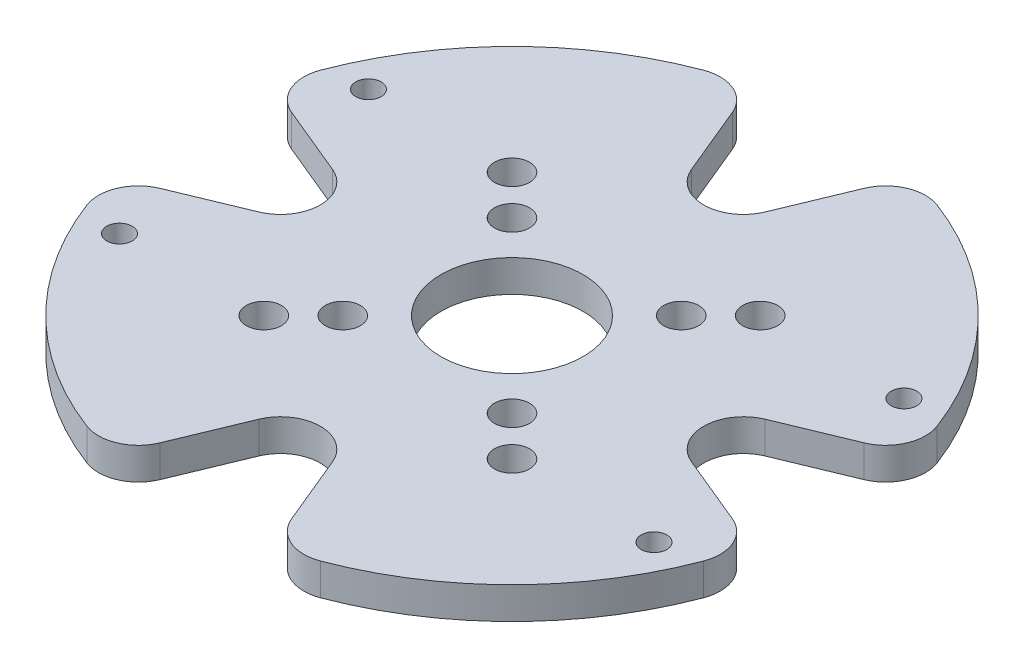
from build123d import *

# Parameters (mm, degrees)
SKETCH1_R                = 41.332242953
SKETCH1_R_2              = 1.6
BOSS_EXTRUDE1_DEPTH      = 4
SKETCH2_R                = 8.913017029
SKETCH2_R_2              = 2.2
CUT_EXTRUDE1_DEPTH       = 12
CUT_EXTRUDE2_START       = -12
CUT_EXTRUDE2_DEPTH       = 12
FILLET1_R                = 5
CIRPATTERN1_COUNT        = 4
FILLET1_OF_CIRPATTERN1_R = 5


with BuildPart() as part:
    # Sketch1 → Boss-Extrude1 (new body)
    with BuildSketch(Plane(origin=(0, 0, 0), x_dir=(1, 0, 0), z_dir=(0, 1, 0))):
        with Locations(Location((-26.014745027, -1.093056514, 0), (0, 0, 270))):
            Circle(SKETCH1_R)
        with Locations(Location((-59.58153309, 14.478552308, 0), (0, 0, 270))):
            Circle(SKETCH1_R_2, mode=Mode.SUBTRACT)
        with Locations(Location((-59.519604899, -16.797470769, 0), (0, 0, 270))):
            Circle(SKETCH1_R_2, mode=Mode.SUBTRACT)
        with Locations(Location((7.490114845, -16.797470769, 0), (0, 0, 270))):
            Circle(SKETCH1_R_2, mode=Mode.SUBTRACT)
        with Locations(Location((7.552043035, 14.478552308, 0), (0, 0, 270))):
            Circle(SKETCH1_R_2, mode=Mode.SUBTRACT)
    extrude(amount=BOSS_EXTRUDE1_DEPTH)

    # Sketch2 → Cut-Extrude1 (cut)
    with BuildSketch(Plane(origin=(0, 4, 0), x_dir=(1, 0, 0), z_dir=(0, 1, 0))):
        with Locations(Location((-26.014745027, -1.093056514, 0), (0, 0, 270))):
            Circle(SKETCH2_R)
        with Locations(Location((-15.408143309, 9.513545204, 0), (0, 0, 270))):
            Circle(SKETCH2_R_2)
        with Locations(Location((-10.458395841, 14.463292672, 0), (0, 0, 270))):
            Circle(SKETCH2_R_2)
        with Locations(Location((-36.621346745, 9.513545204, 0), (0, 0, 270))):
            Circle(SKETCH2_R_2)
        with Locations(Location((-41.571094213, 14.463292672, 0), (0, 0, 270))):
            Circle(SKETCH2_R_2)
        with Locations(Location((-36.621346745, -11.699658232, 0), (0, 0, 270))):
            Circle(SKETCH2_R_2)
        with Locations(Location((-41.571094213, -16.6494057, 0), (0, 0, 270))):
            Circle(SKETCH2_R_2)
        with Locations(Location((-15.408143309, -11.699658232, 0), (0, 0, 270))):
            Circle(SKETCH2_R_2)
        with Locations(Location((-10.458395841, -16.6494057, 0), (0, 0, 270))):
            Circle(SKETCH2_R_2)
    extrude(amount=-CUT_EXTRUDE1_DEPTH, mode=Mode.SUBTRACT)

    # Sketch4 → Cut-Extrude2 (cut)
    with BuildSketch(Plane(origin=(0, 4, 0), x_dir=(1, 0, 0), z_dir=(0, 1, 0)).offset(CUT_EXTRUDE2_START)):
        with BuildLine():
            Line((-66.119037909, 8.906943486), (-41.976902285, -1.093056514))
            Line((-41.976902285, -1.093056514), (-66.119037909, -11.093056514))
            ThreePointArc((-66.119037909, -11.093056514), (-67.34698798, -1.093056514), (-66.119037909, 8.906943486))
        make_face()
    cut_extrude2 = extrude(amount=CUT_EXTRUDE2_DEPTH, mode=Mode.SUBTRACT)

    # Fillet1
    fillet1_edges = [part.edges().sort_by_distance(p)[0] for p in [
        (-66.119037909, 2, 11.093056514),
        (-66.119037909, 2, -8.906943486),
        (-41.976902285, 2, 1.093056514),
    ]]
    fillet(fillet1_edges, radius=FILLET1_R)

    # CirPattern1: Cut-Extrude2 ×4 about axis
    cirpattern1_axis = Axis((-26.014745027, 0, 1.093056514), (0, 1, 0))
    for i in range(1, CIRPATTERN1_COUNT):
        add(cut_extrude2.rotate(cirpattern1_axis, i * 360 / CIRPATTERN1_COUNT), mode=Mode.SUBTRACT)

    # Fillet1 of CirPattern1
    fillet1_of_cirpattern1_edges = [part.edges().sort_by_distance(p)[0] for p in [
        (-16.014745027, 2, 41.197349395),
        (-36.014745027, 2, 41.197349395),
        (-26.014745027, 2, 17.055213772),
        (14.089547854, 2, -8.906943486),
        (14.089547854, 2, 11.093056514),
        (-10.052587769, 2, 1.093056514),
        (-36.014745027, 2, -39.011236368),
        (-16.014745027, 2, -39.011236368),
        (-26.014745027, 2, -14.869100744),
    ]]
    fillet(fillet1_of_cirpattern1_edges, radius=FILLET1_OF_CIRPATTERN1_R)


solid = part.part
